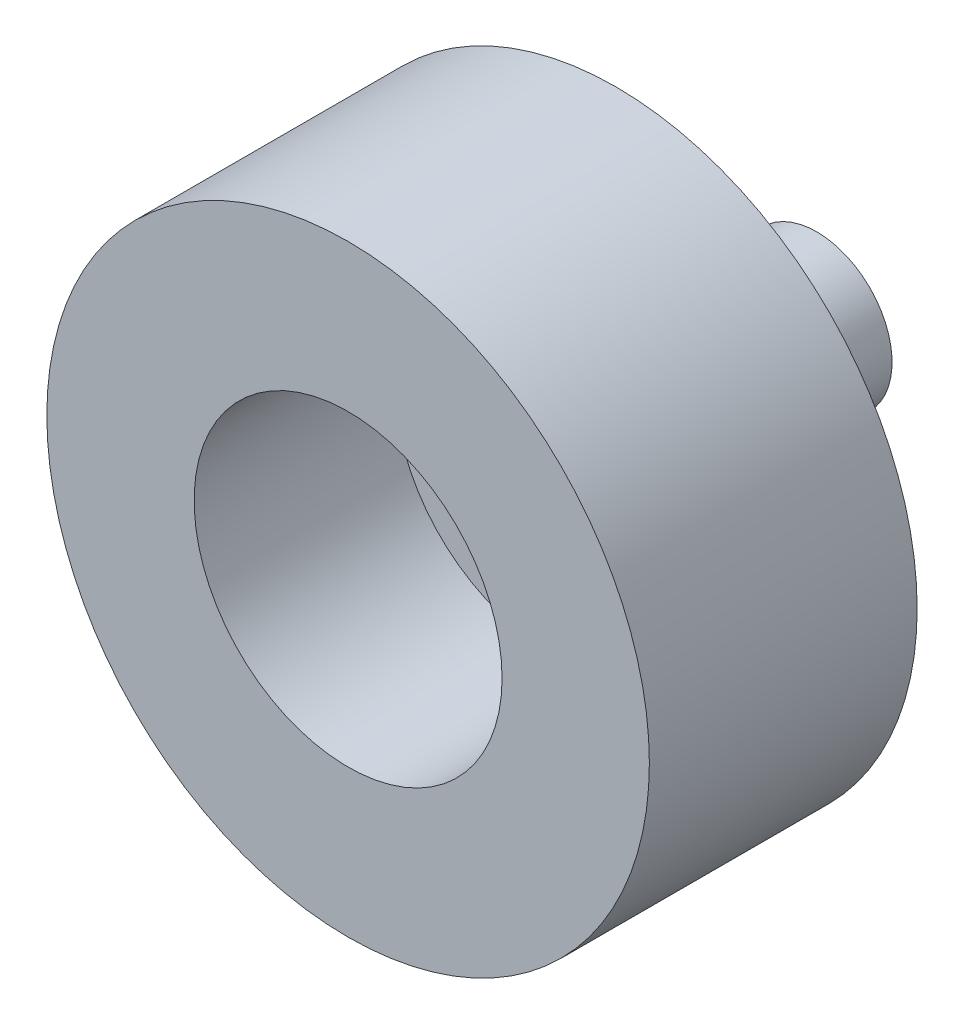
from build123d import *

# Parameters (mm, degrees)
ESBO_O2_R                = 4.5
RESSALTO_EXTRUS_O1_DEPTH = 1
ESBO_O3_R                = 1.125
RESSALTO_EXTRUS_O2_DEPTH = 3
ESBO_O4_R                = 4.5
ESBO_O4_R_2              = 2.3
RESSALTO_EXTRUS_O3_DEPTH = 3


with BuildPart() as part:
    # Esboço2 → Ressalto-extrusão1 (new body)
    with BuildSketch(Plane.XY):
        Circle(ESBO_O2_R)
    extrude(amount=RESSALTO_EXTRUS_O1_DEPTH)

    # Esboço3 → Ressalto-extrusão2 (add)
    with BuildSketch(Plane(origin=(0, 0, 0), x_dir=(-1, 0, 0), z_dir=(0, 0, -1))):
        Circle(ESBO_O3_R)
    extrude(amount=RESSALTO_EXTRUS_O2_DEPTH)

    # Esboço4 → Ressalto-extrusão3 (add)
    with BuildSketch(Plane.XY.offset(1)):
        Circle(ESBO_O4_R)
        Circle(ESBO_O4_R_2, mode=Mode.SUBTRACT)
    extrude(amount=RESSALTO_EXTRUS_O3_DEPTH)


solid = part.part
